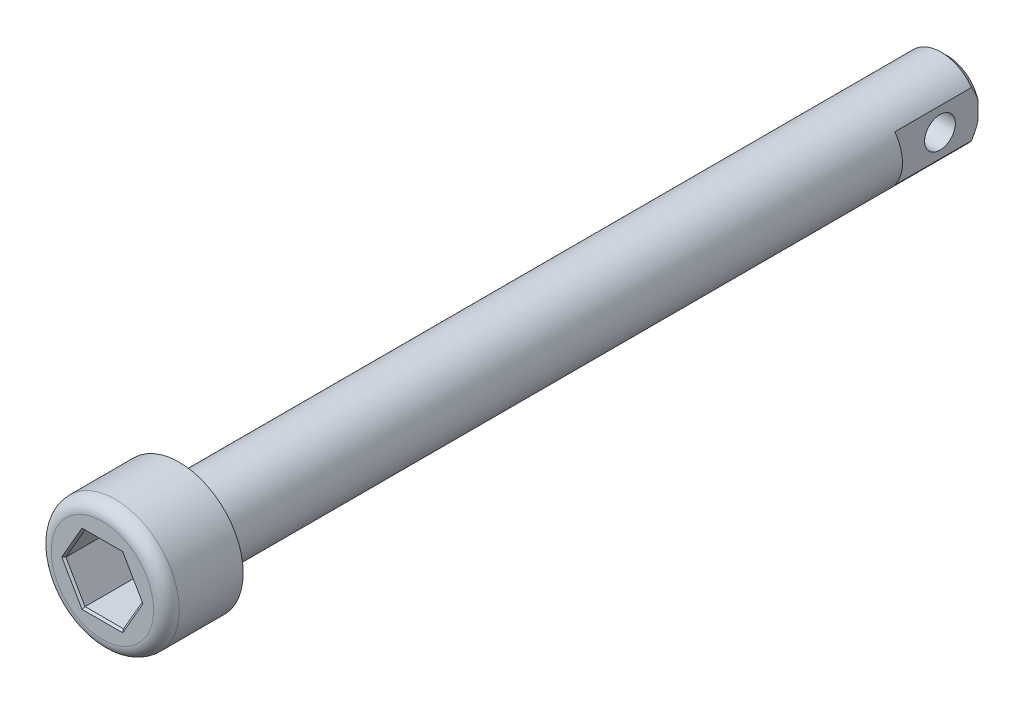
from build123d import *

# Parameters (mm, degrees)
ESQUISSE1_R             = 5
BASE_EXTRUSION_DEPTH    = 6
ENL_V_MAT_EXTRU_1_DEPTH = 4
CONG_1_R                = 1
CHANFREIN3_SIZE         = 0.15
ESQUISSE4_R             = 3
BOSS_EXTRU_1_DEPTH      = 60
CHANFREIN4_SIZE         = 0.5
ESQUISSE5_W             = 1.725795971
ESQUISSE5_H             = 5.746530977
ENL_V_MAT_EXTRU_2_DEPTH = 6.5
ESQUISSE6_W             = 1.6
ESQUISSE6_H             = 6
ENL_V_MAT_EXTRU_3_DEPTH = 6.5
ESQUISSE7_R             = 1.2
ENL_V_MAT_EXTRU_4_DEPTH = 61.661025379


with BuildPart() as part:
    # Esquisse1 → Base-Extrusion (new body)
    with BuildSketch(Plane.XY):
        Circle(ESQUISSE1_R)
    extrude(amount=BASE_EXTRUSION_DEPTH)

    # Esquisse3 → Enlèv. mat.-Extru.1 (cut)
    with BuildSketch(Plane.XY.offset(6)):
        Polygon((-3, 0), (-1.502673246, 2.596530977), (1.502673246, 2.596530977), (3, 0), (1.502673246, -2.596530977), (-1.502673246, -2.596530977), align=None)
    extrude(amount=-ENL_V_MAT_EXTRU_1_DEPTH, mode=Mode.SUBTRACT)

    # Congé1
    cong_1_edges = [part.edges().sort_by_distance(p)[0] for p in [
        (-5, 0, 6),
    ]]
    fillet(cong_1_edges, radius=CONG_1_R)

    # Chanfrein3
    chanfrein3_edges = [part.edges().sort_by_distance(p)[0] for p in [
        (-2.251336623, -1.298265489, 6),
        (0, -2.596530977, 6),
        (2.251336623, -1.298265489, 6),
        (2.251336623, 1.298265489, 6),
        (0, 2.596530977, 6),
        (-2.251336623, 1.298265489, 6),
    ]]
    chamfer(chanfrein3_edges, length=CHANFREIN3_SIZE)

    # Esquisse4 → Boss.-Extru.1 (add)
    with BuildSketch(Plane(origin=(0, 0, 0), x_dir=(-1, 0, 0), z_dir=(0, 0, -1))):
        with Locations(Location((0, 0, 0), (0, 0, 216.869897646))):
            Circle(ESQUISSE4_R)
    extrude(amount=BOSS_EXTRU_1_DEPTH)

    # Chanfrein4
    chanfrein4_edges = [part.edges().sort_by_distance(p)[0] for p in [
        (-2.4, 1.8, -60),
    ]]
    chamfer(chanfrein4_edges, length=CHANFREIN4_SIZE)

    # Esquisse5 → Enlèv. mat.-Extru.2 (cut)
    with BuildSketch(Plane(origin=(0, 0, -60), x_dir=(-1, 0, 0), z_dir=(0, 0, -1))):
        with Locations((-3.262897986, 0.126734511)):
            Rectangle(ESQUISSE5_W, ESQUISSE5_H)
    extrude(amount=-ENL_V_MAT_EXTRU_2_DEPTH, mode=Mode.SUBTRACT)

    # Esquisse6 → Enlèv. mat.-Extru.3 (cut)
    with BuildSketch(Plane(origin=(0, 0, -60), x_dir=(-1, 0, 0), z_dir=(0, 0, -1))):
        with Locations((3.2, 0)):
            Rectangle(ESQUISSE6_W, ESQUISSE6_H)
    extrude(amount=-ENL_V_MAT_EXTRU_3_DEPTH, mode=Mode.SUBTRACT)

    # Esquisse7 → Enlèv. mat.-Extru.4 (cut, through all)
    with BuildSketch(Plane(origin=(2.4, 0, 0), x_dir=(0, 0, -1), z_dir=(1, 0, 0))):
        with Locations((57.030411383, 0)):
            Circle(ESQUISSE7_R)
    extrude(amount=-ENL_V_MAT_EXTRU_4_DEPTH, mode=Mode.SUBTRACT)


solid = part.part
